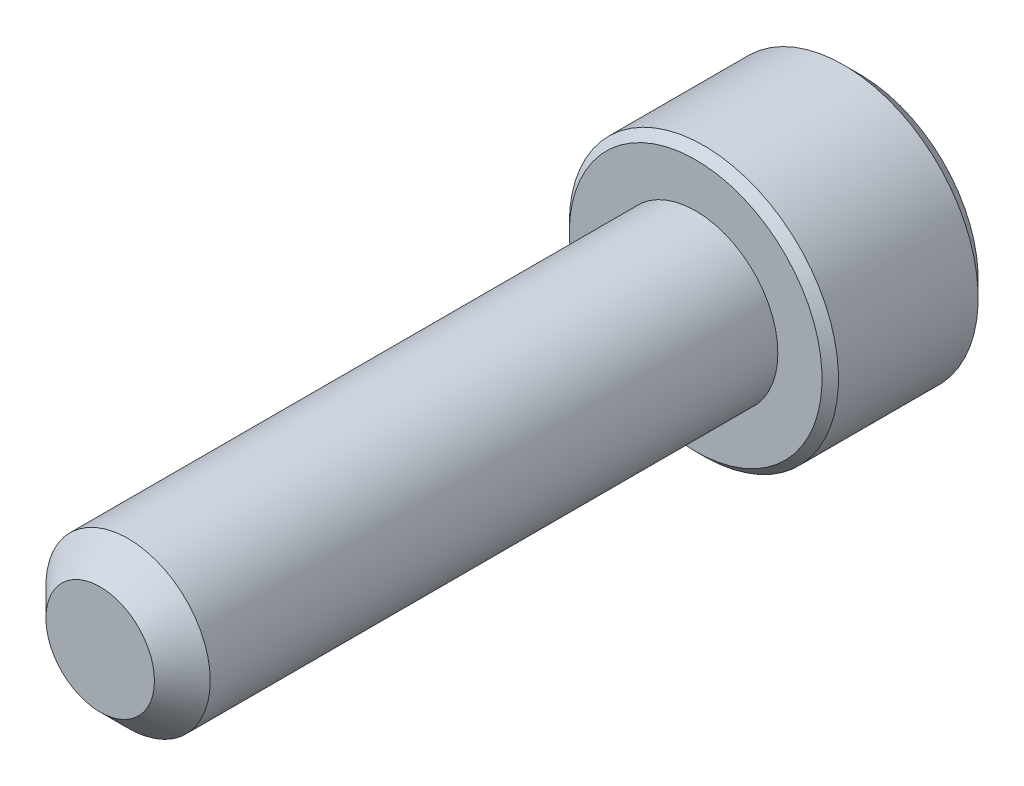
from build123d import *

# Parameters (mm, degrees)
SKETCH1_R          = 1.7526
EXTRUDE1_DEPTH     = 12.7
CHAMFER3_SIZE      = 0.5953125
SKETCH6_R          = 2.8702
EXTRUDE2_DEPTH     = 3.5052
CUT_EXTRUDE1_DEPTH = 2.08359375
SKETCH8_R          = 1.603951217
CUT_EXTRUDE2_DEPTH = 0.35052
CUT_EXTRUDE2_DRAFT = -45
CHAMFER1_SIZE      = 0.35052
CHAMFER2_SIZE      = 0.17526


with BuildPart() as part:
    # Sketch1 → Extrude1 (new body)
    with BuildSketch(Plane.XY):
        Circle(SKETCH1_R)
    extrude(amount=-EXTRUDE1_DEPTH)

    # Chamfer3
    chamfer3_edges = [part.edges().sort_by_distance(p)[0] for p in [
        (-1.7526, 0, 0),
    ]]
    chamfer(chamfer3_edges, length=CHAMFER3_SIZE)

    # Sketch6 → Extrude2 (add)
    with BuildSketch(Plane(origin=(0, 0, -12.7), x_dir=(-1, 0, 0), z_dir=(0, 0, -1))):
        Circle(SKETCH6_R)
    extrude(amount=EXTRUDE2_DEPTH)

    # Sketch7 → Cut-Extrude1 (cut)
    with BuildSketch(Plane(origin=(0, 0, -16.2052), x_dir=(-1, 0, 0), z_dir=(0, 0, -1))):
        Polygon((0, 1.603951217), (-1.3890625, 0.801975608), (-1.3890625, -0.801975608), (0, -1.603951217), (1.3890625, -0.801975608), (1.3890625, 0.801975608), align=None)
    extrude(amount=-CUT_EXTRUDE1_DEPTH, mode=Mode.SUBTRACT)


with BuildPart() as cut_extrude2_tool:
    # Sketch8 → Cut-Extrude2 (with draft: the straight prism first)
    with BuildSketch(Plane(origin=(0, 0, -16.2052), x_dir=(-1, 0, 0), z_dir=(0, 0, -1))):
        Circle(SKETCH8_R)
    extrude(amount=-CUT_EXTRUDE2_DEPTH)
    # Cut-Extrude2: the draft: its side faces are tilted about the plane it starts from
    cut_extrude2_sides = [cut_extrude2_tool.faces().sort_by_distance(p)[0] for p in [
        (1.603951217, 0, -16.02994),
    ]]
    draft(cut_extrude2_sides, Plane(origin=(0, 0, -16.2052), x_dir=(-1, 0, 0), z_dir=(0, 0, -1)), CUT_EXTRUDE2_DRAFT)


with BuildPart() as part_1:
    add(part.part)

    # Cut-Extrude2: cut by cut_extrude2_tool
    add(cut_extrude2_tool.part, mode=Mode.SUBTRACT)

    # Chamfer1
    chamfer1_edges = [part_1.edges().sort_by_distance(p)[0] for p in [
        (2.8702, 0, -16.2052),
    ]]
    chamfer(chamfer1_edges, length=CHAMFER1_SIZE)

    # Chamfer2
    chamfer2_edges = [part_1.edges().sort_by_distance(p)[0] for p in [
        (2.8702, 0, -12.7),
    ]]
    chamfer(chamfer2_edges, length=CHAMFER2_SIZE)


solid = part_1.part
